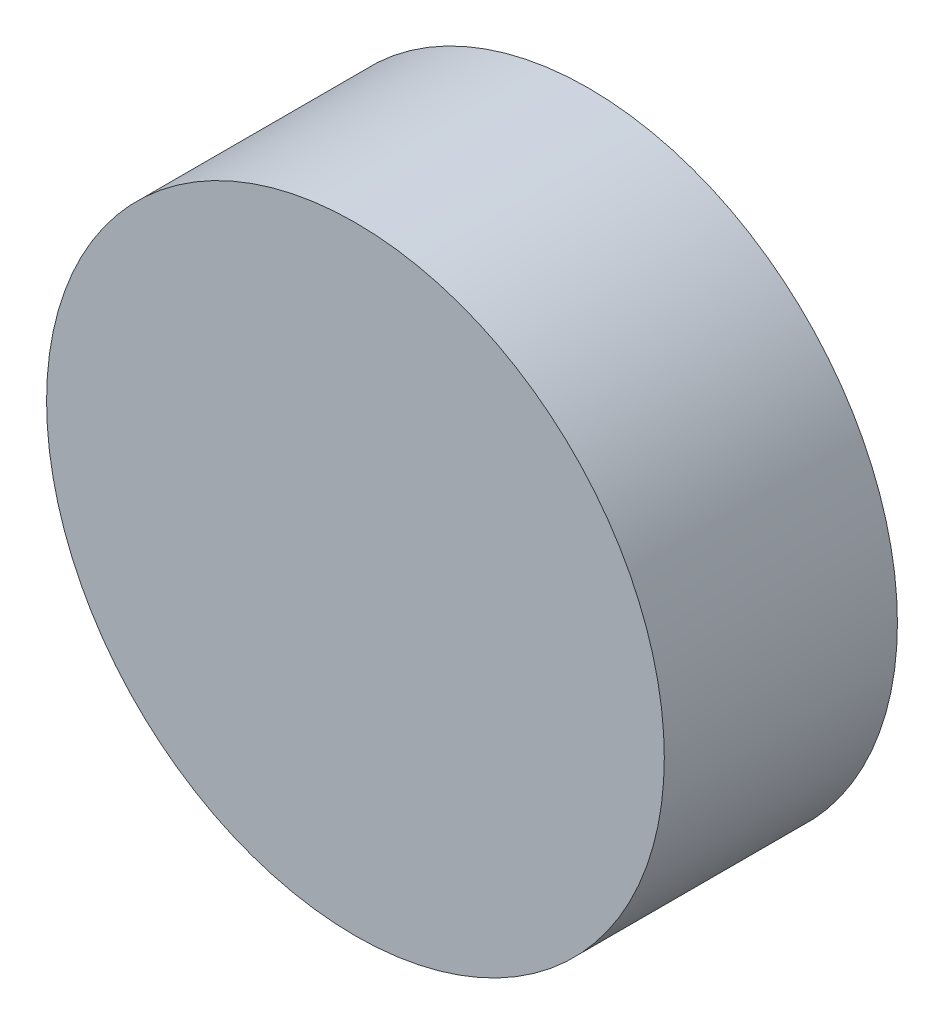
from build123d import *

# Parameters (mm, degrees)
SKETCH1_R           = 26.5
BOSS_EXTRUDE1_DEPTH = 20


with BuildPart() as part:
    # Sketch1 → Boss-Extrude1 (new body)
    with BuildSketch(Plane.XY):
        Circle(SKETCH1_R)
    extrude(amount=BOSS_EXTRUDE1_DEPTH)


solid = part.part
